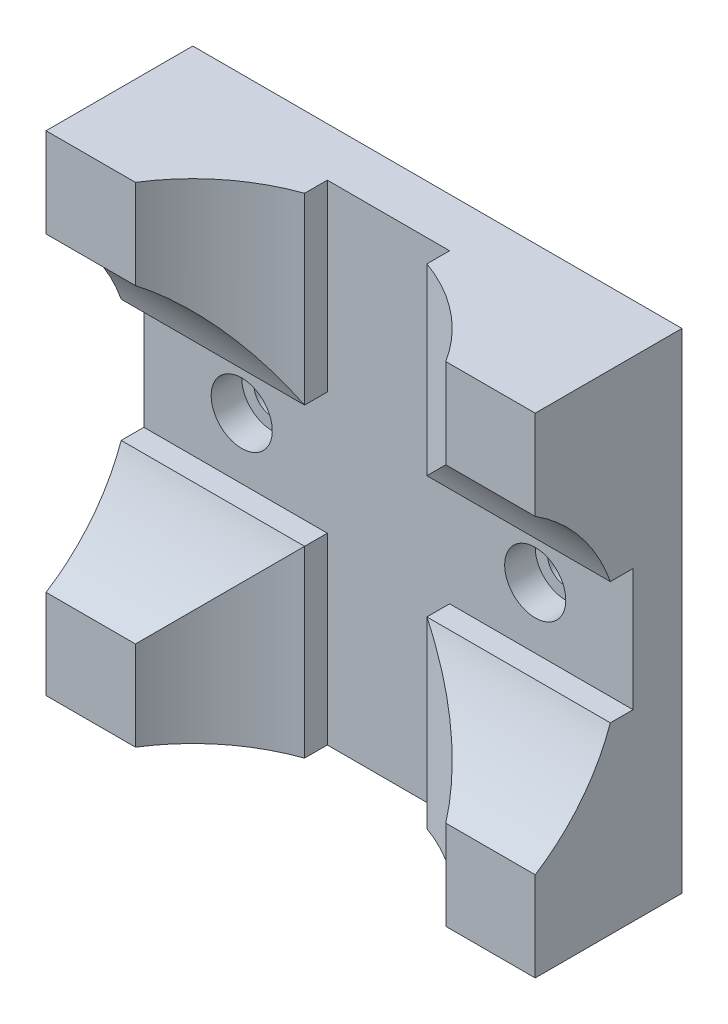
from build123d import *

# Parameters (mm, degrees)
SKETCH1_W           = 40
SKETCH1_H           = 40
BOSS_EXTRUDE1_DEPTH = 12
CUT_EXTRUDE1_DEPTH  = 40
SKETCH3_R           = 2.5
CUT_EXTRUDE3_DEPTH  = 40
SKETCH3_5_R         = 2.5
SKETCH3_5_R_2       = 1.5
BOSS_EXTRUDE3_DEPTH = 1.5
CIRPATTERN3_COUNT   = 2
CIRPATTERN3_ANGLE   = 90


with BuildPart() as part:
    # Sketch1 → Boss-Extrude1 (new body)
    with BuildSketch(Plane.XY):
        with Locations((20, 20)):
            Rectangle(SKETCH1_W, SKETCH1_H)
    extrude(amount=BOSS_EXTRUDE1_DEPTH)

    # Sketch2 → Cut-Extrude1 (cut)
    with BuildSketch(Plane(origin=(40, 0, 0), x_dir=(0, 0, -1), z_dir=(1, 0, 0))):
        with BuildLine():
            Line((-5, 25), (-4, 25))
            Line((-4, 25), (-4, 15))
            Line((-4, 15), (-5, 15))
            Line((-5, 15), (-5.857864376, 15))
            ThreePointArc((-5.857864376, 15), (-35, 20), (-5.857864376, 25))
            Line((-5.857864376, 25), (-5, 25))
        make_face()
    cut_extrude1 = extrude(amount=-CUT_EXTRUDE1_DEPTH, mode=Mode.SUBTRACT)

    # Sketch3 → Cut-Extrude3 (cut)
    with BuildSketch(Plane(origin=(0, 0, 0), x_dir=(-1, 0, 0), z_dir=(0, 0, -1))):
        with Locations((-32, 20)):
            Circle(SKETCH3_R)
        with Locations((-8, 20)):
            Circle(SKETCH3_R)
    extrude(amount=-CUT_EXTRUDE3_DEPTH, mode=Mode.SUBTRACT)

    # Sketch3<5> → Boss-Extrude3 (add)
    # profile 1 of 2: a face of its own
    with BuildSketch(Plane(origin=(0, 0, 0), x_dir=(-1, 0, 0), z_dir=(0, 0, -1))):
        with Locations((-32, 20)):
            Circle(SKETCH3_5_R)
        with Locations((-32, 20)):
            Circle(SKETCH3_5_R_2, mode=Mode.SUBTRACT)
    # profile 2 of 2: a face of its own
    with BuildSketch(Plane(origin=(0, 0, 0), x_dir=(-1, 0, 0), z_dir=(0, 0, -1))):
        with Locations((-8, 20)):
            Circle(SKETCH3_5_R)
        with Locations((-8, 20)):
            Circle(SKETCH3_5_R_2, mode=Mode.SUBTRACT)
    extrude(amount=-BOSS_EXTRUDE3_DEPTH)

    # CirPattern3: Cut-Extrude1 ×2 about axis
    cirpattern3_axis = Axis((20, 20, 4), (0, 0, 1))
    for i in range(1, CIRPATTERN3_COUNT):
        add(cut_extrude1.rotate(cirpattern3_axis, i * CIRPATTERN3_ANGLE / (CIRPATTERN3_COUNT - 1)), mode=Mode.SUBTRACT)


solid = part.part
